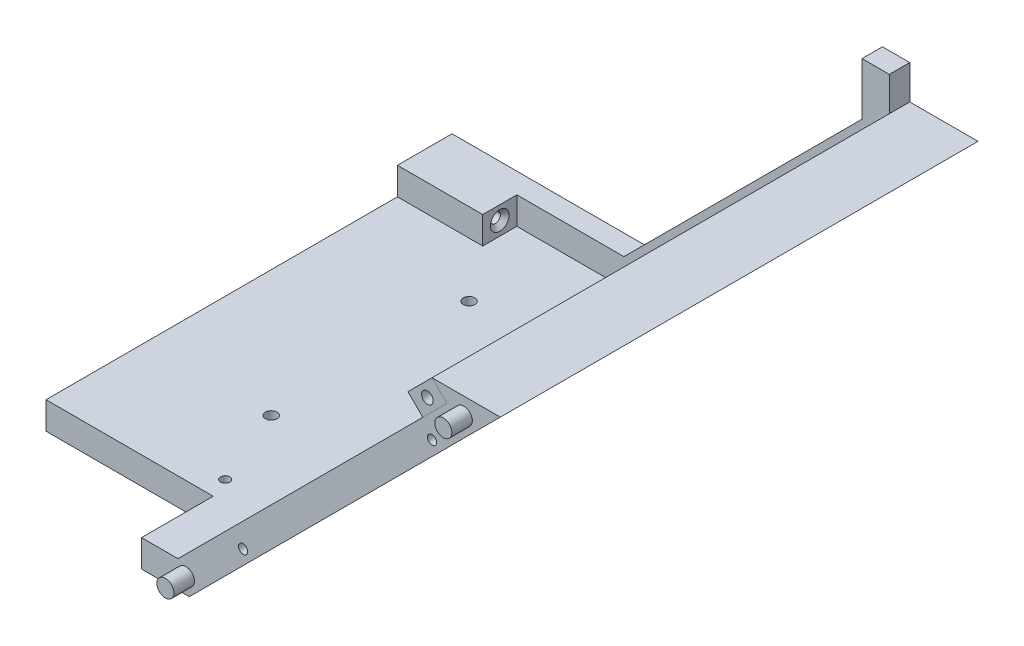
from build123d import *

# Parameters (mm, degrees)
MAIN_EXTRUSION_DEPTH                     = 140
LCD_HOLE_SKETCH_W                        = 49
LCD_HOLE_SKETCH_H                        = 21
LCD_HOLE_DEPTH                           = 225.223426519
LCD_FIX_SKETCH_R                         = 1.35
LCD_FIX_DEPTH                            = 7
BOTTOM_REINFORCEMENT_EXTRUSION_DEPTH     = 6
POWER_BOARD_HOLE_SKETCH_W                = 82
POWER_BOARD_HOLE_SKETCH_H                = 73.90556621
POWER_BOARD_HOLE_DEPTH                   = 271.348052911
POWER_BOARD_WINDOW_SKETCH_W              = 94
POWER_BOARD_WINDOW_SKETCH_H              = 85.90556621
POWER_BOARD_WINDOW_DEPTH                 = 5
POWER_BOARD_WINDOW_FIX_SKETCH_R          = 1.35
POWER_BOARD_WINDOW_FIX_DEPTH             = 229.45860527
POWERBOARD_FIX_SKETCH_R                  = 4
POWERBOARD_FIX_EXTRUSION_DEPTH           = 5
POWERBOARD_FIX_HOLE_SKETCH_R             = 1.35
POWERBOARD_FIX_HOLE_DEPTH                = 229.526141255
TOP_FIX_SKETCH_R                         = 2.5
TOP_FIX_DEPTH                            = 6
TOP_FIX_HOLE_SKETCH_R                    = 1.35
TOP_FIX_HOLE_DEPTH                       = 30
BOSS_EXTRU_2_DEPTH                       = 10
FIX_SKETCH_R                             = 2.5
FIX_HOLE_DEPTH                           = 10
BOTTOM_FIX_EXTRUSION_REACH               = 237.18
BOTTOM_FIX_REINFORCEMENT_SKETCH_W        = 25
BOTTOM_FIX_REINFORCEMENT_SKETCH_H        = 10
BOTTOM_FIX_REINFORCEMENT_EXTRUSION_DEPTH = 8
HDD_FIX_LINEAR_REPEAT_COUNT              = 2
HDD_FIX_LINEAR_REPEAT_PITCH              = 58


with BuildPart() as part:
    # Main-Sketch → Main-Extrusion (new body)
    with BuildSketch(Plane.XY):
        Polygon((0, 0), (63, 0), (154.15, 91.15), (134.15, 91.15), (138.493145751, 86.806854249), (59.686291501, 8), (0, 8), align=None)
    extrude(amount=MAIN_EXTRUSION_DEPTH)

    # Lcd-Hole-Sketch → Lcd-Hole (cut, through all)
    with BuildSketch(Plane(origin=(0, 8, 0), x_dir=(-1, 0, 0), z_dir=(0, 1, 0))):
        with Locations((-24.5, 129.5)):
            Rectangle(LCD_HOLE_SKETCH_W, LCD_HOLE_SKETCH_H)
    extrude(amount=-LCD_HOLE_DEPTH, mode=Mode.SUBTRACT)

    # Lcd-Fix-Sketch → Lcd-Fix (cut)
    with BuildSketch(Plane(origin=(0, 8, 0), x_dir=(1, 0, 0), z_dir=(0, 1, 0))):
        with Locations(Location((46.5, -113, 0), (0, 0, 270))):
            Circle(LCD_FIX_SKETCH_R)
    extrude(amount=-LCD_FIX_DEPTH, mode=Mode.SUBTRACT)

    # Power-Board-Hole-Sketch → Power-Board-Hole (cut, through all)
    with BuildSketch(Plane(origin=(22.424380529, -40.575619471, 188.812816497), x_dir=(0, 0, -1), z_dir=(0.707106781186549, -0.7071067811865461, 0))):
        with Locations((109.812816497, 117.335374462)):
            Rectangle(POWER_BOARD_HOLE_SKETCH_W, POWER_BOARD_HOLE_SKETCH_H)
    extrude(amount=-POWER_BOARD_HOLE_DEPTH, mode=Mode.SUBTRACT)

    # Power-Board-Window-Sketch → Power-Board-Window (cut)
    with BuildSketch(Plane(origin=(22.424380529, -40.575619471, 188.812816497), x_dir=(0, 0, -1), z_dir=(0.707106781186549, -0.7071067811865461, 0))):
        with Locations((109.812816497, 117.335374462)):
            Rectangle(POWER_BOARD_WINDOW_SKETCH_W, POWER_BOARD_WINDOW_SKETCH_H)
    extrude(amount=-POWER_BOARD_WINDOW_DEPTH, mode=Mode.SUBTRACT)

    # Power-Board-Window-Fix-Sketch → Power-Board-Window-Fix (cut, through all)
    with BuildSketch(Plane(origin=(27.964466094, -27.964466094, 0), x_dir=(0, 0, -1), z_dir=(0.7071067811865489, -0.7071067811865461, 0))):
        with Locations(Location((-123, 104.50051032, 0), (0, 0, 90))):
            Circle(POWER_BOARD_WINDOW_FIX_SKETCH_R)
        with Locations(Location((-35, 104.50051032, 0), (0, 0, 90))):
            Circle(POWER_BOARD_WINDOW_FIX_SKETCH_R)
        with Locations(Location((-79, 144.453293425, 0), (0, 0, 90))):
            Circle(POWER_BOARD_WINDOW_FIX_SKETCH_R)
        with Locations(Location((-79, 64.547727215, 0), (0, 0, 90))):
            Circle(POWER_BOARD_WINDOW_FIX_SKETCH_R)
    extrude(amount=-POWER_BOARD_WINDOW_FIX_DEPTH, mode=Mode.SUBTRACT)

    # PowerBoard-Fix-Sketch → PowerBoard-Fix-Extrusion (add)
    with BuildSketch(Plane(origin=(25.843145751, -25.843145751, 0), x_dir=(0, 0, 1), z_dir=(-0.7071067811865487, 0.7071067811865465, 0))):
        with Locations(Location((13, 137.311157801, 0), (0, 0, 90))):
            Circle(POWERBOARD_FIX_SKETCH_R)
        with Locations(Location((11, 68.311157801, 0), (0, 0, 90))):
            Circle(POWERBOARD_FIX_SKETCH_R)
    extrude(amount=POWERBOARD_FIX_EXTRUSION_DEPTH)

    # PowerBoard-Fix-Hole-Sketch → PowerBoard-Fix-Hole (cut, through all)
    with BuildSketch(Plane(origin=(22.307611845, -22.307611845, 0), x_dir=(0, 0, 1), z_dir=(-0.7071067811865486, 0.7071067811865465, 0))):
        with Locations(Location((13, 137.311157801, 0), (0, 0, 270))):
            Circle(POWERBOARD_FIX_HOLE_SKETCH_R)
        with Locations(Location((11, 68.311157801, 0), (0, 0, 270))):
            Circle(POWERBOARD_FIX_HOLE_SKETCH_R)
    extrude(amount=-POWERBOARD_FIX_HOLE_DEPTH, mode=Mode.SUBTRACT)

    # Top-Fix-Sketch → Top-Fix (add)
    with BuildSketch(Plane.XY.offset(140)):
        with Locations((62, 4.656854249)):
            Circle(TOP_FIX_SKETCH_R)
        with Locations((143.446180474, 86.096460213)):
            Circle(TOP_FIX_SKETCH_R)
    extrude(amount=TOP_FIX_DEPTH)

    # Top-Fix-Hole-Sketch → Top-Fix-Hole (cut)
    with BuildSketch(Plane.XY.offset(140)):
        with Locations((78.757359313, 20)):
            Circle(TOP_FIX_HOLE_SKETCH_R)
        with Locations((134.15, 75.392640687)):
            Circle(TOP_FIX_HOLE_SKETCH_R)
    extrude(amount=-TOP_FIX_HOLE_DEPTH, mode=Mode.SUBTRACT)

    # Fix-Sketch → Fix-Hole (cut)
    with BuildSketch(Plane.ZY):
        with Locations((104, 4)):
            Circle(FIX_SKETCH_R)
        with Locations((74, 4)):
            Circle(FIX_SKETCH_R)
        with Locations((44, 4)):
            Circle(FIX_SKETCH_R)
        with Locations((14, 4)):
            Circle(FIX_SKETCH_R)
    extrude(amount=-FIX_HOLE_DEPTH, mode=Mode.SUBTRACT)


with BuildPart() as body_2:
    # Bottom-Reinforcement-Sketch → Bottom-Reinforcement-Extrusion (new body)
    with BuildSketch(Plane.XY):
        Polygon((59.686291501, 8), (138.493145751, 86.806854249), (134.15, 91.15), (134.15, 101.15), (126.15, 101.15), (126.15, 85.777416998), (56.372583002, 16), (0, 16), (0, 8), align=None)
    extrude(amount=BOTTOM_REINFORCEMENT_EXTRUSION_DEPTH)


with BuildPart() as body_3:
    # Esquisse3 → Boss.-Extru.2 (new body)
    with BuildSketch(Plane.XY.offset(140)):
        Polygon((138.493145751, 86.806854249), (134.15, 91.15), (127.078932188, 84.078932188), (131.422077939, 79.735786438), align=None)
    extrude(amount=-BOSS_EXTRU_2_DEPTH)

    # Esquisse4 → Fraisage pour vis à tête fraisée M31 (revolve, cut)
    with BuildSketch(Plane(origin=(132.785283912, 85.443648276, 130), x_dir=(0, 1, 0), z_dir=(1, 0, 0))):
        Polygon((0, 0), (0, 10.001), (1.7, 10.001), (1.7, 1.3), (3, 0), align=None)
    revolve(axis=Axis((132.785283912, 85.443648276, 123.65), (0, 0, 1)), mode=Mode.SUBTRACT)


with BuildPart() as bottom_fix_extrusion_tool:
    # Bottom-Fix-Extrusion: up to this plane
    bottom_fix_extrusion_end = Plane(origin=(15.495190528, 0, 4.151923789), z_dir=(-0.9659258262890681, 0, -0.25881904510252135))
    # Bottom-Fix-Sketch → Bottom-Fix-Extrusion (new, up to the surface)
    with BuildSketch(Plane.ZY, mode=Mode.PRIVATE) as bottom_fix_extrusion_sk1:
        Polygon((0, 12.5), (6, 11.5), (6, 3.5), (0, 2.5), align=None)
    bottom_fix_extrusion_tool1 = split(extrude(bottom_fix_extrusion_sk1.sketch, amount=-BOTTOM_FIX_EXTRUSION_REACH, mode=Mode.PRIVATE), bisect_by=bottom_fix_extrusion_end, keep=Keep.BOTH, mode=Mode.PRIVATE)
    add(bottom_fix_extrusion_tool1.solids().sort_by_distance((0, 7.5, 2.888889))[0])


with BuildPart() as part_1:
    add(part.part)

    # Bottom-Fix-Extrusion: cut by bottom_fix_extrusion_tool
    add(bottom_fix_extrusion_tool.part, mode=Mode.SUBTRACT)



with BuildPart() as body_2_1:
    add(body_2.part)

    # Bottom-Fix-Extrusion: cut by bottom_fix_extrusion_tool
    add(bottom_fix_extrusion_tool.part, mode=Mode.SUBTRACT)


with BuildPart() as part_2:
    add(part_1.part)

    add(body_2_1.part)  # Bottom-Fix-Reinforcement-Extrusion merges body 2
    # Bottom-Fix-Reinforcement-Sketch → Bottom-Fix-Reinforcement-Extrusion (add)
    with BuildSketch(Plane(origin=(0, 8, 0), x_dir=(1, 0, 0), z_dir=(0, 1, 0))):
        with Locations((12.5, -11)):
            Rectangle(BOTTOM_FIX_REINFORCEMENT_SKETCH_W, BOTTOM_FIX_REINFORCEMENT_SKETCH_H)
    extrude(amount=BOTTOM_FIX_REINFORCEMENT_EXTRUSION_DEPTH)

    # Esquisse9 → Fraisage pour vis à tête fraisée M2.51 (revolve, cut)
    with BuildSketch(Plane(origin=(25, 12, 11), x_dir=(0, 0, -1), z_dir=(0, 1, 0))):
        Polygon((0, 0), (0, 25), (1.45, 25), (1.45, 1.3), (2.75, 0), align=None)
    revolve(axis=Axis((31.35, 12, 11), (-1, 0, 0)), mode=Mode.SUBTRACT)

    # Esquisse12 → Fraisage pour vis à tête fraisée M32 (revolve, cut)
    with BuildSketch(Plane(origin=(37, 0, 90), x_dir=(0, 0, -1), z_dir=(1, 0, 0))):
        Polygon((0, 0), (0, 101.15), (1.7, 101.15), (1.7, 1.45), (3.15, 0), align=None)
    fraisage_pour_vis_t_te_frais_e_m32 = revolve(axis=Axis((37, -6.35, 90), (0, 1, 0)), mode=Mode.SUBTRACT)

    # HDD-Fix-Linear-Repeat: Fraisage pour vis à tête fraisée M32 ×2
    with Locations(*[(0, 0, -i * HDD_FIX_LINEAR_REPEAT_PITCH) for i in range(1, HDD_FIX_LINEAR_REPEAT_COUNT)]):
        add(fraisage_pour_vis_t_te_frais_e_m32, mode=Mode.SUBTRACT)


solid = Compound([body_3.part, part_2.part])
